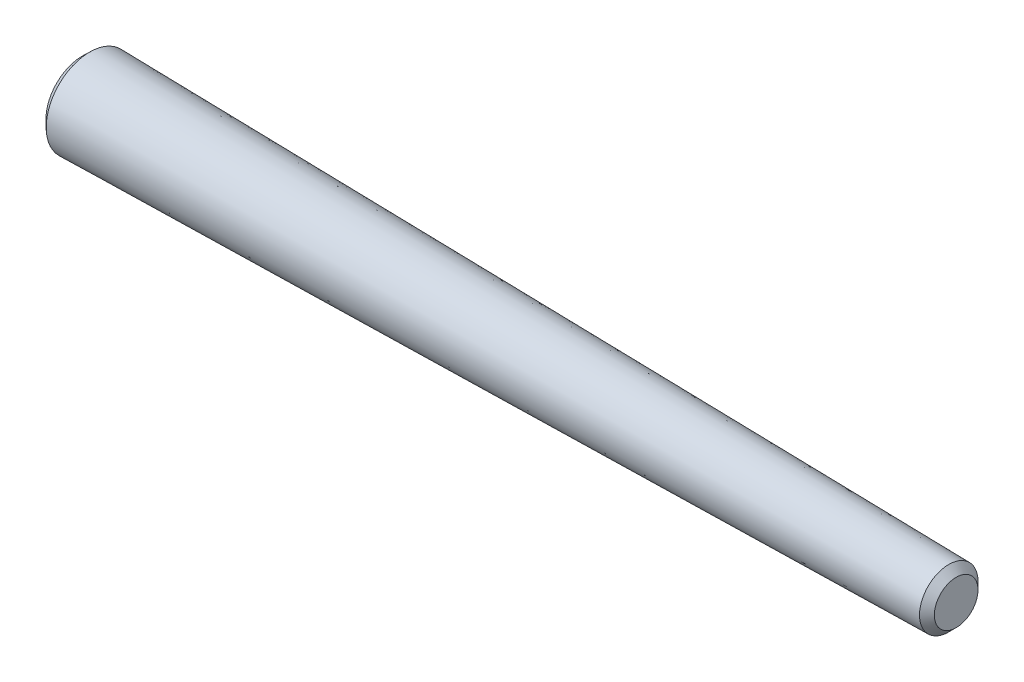
from build123d import *
from OCP.BRepFilletAPI import BRepFilletAPI_MakeChamfer

# Parameters (mm, degrees)
CHAMFER1_SIZE    = 0.5
CHAMFER1_SIZE2   = 0.508545193
CHAMFER1_SIZE2_2 = 0.49187158


with BuildPart() as part:
    # Sketch1 → Revolve1 (revolve)
    with BuildSketch(Plane.XY, mode=Mode.PRIVATE) as revolve1_sk:
        Polygon((0, 0), (0, 3), (60, 2), (60, 0), align=None)
    revolve(revolve1_sk.sketch.rotate(Axis((0, 0, 0), (1, 0, 0)), 90), axis=Axis((0, 0, 0), (1, 0, 0)))

    # Chamfer1: one chamfer whose edges measure the first distance from different faces: ONE call of the kernel's chamfer builder (chamfer() names one face for all edges)
    chamfer1_edges_1 = [part.edges().sort_by_distance(p)[0] for p in [
        (60, 0, -2),
    ]]
    chamfer1_side_1 = [part.faces().sort_by_distance(p)[0] for p in [
        (60, 0, 0),
    ]]
    chamfer1_edges_2 = [part.edges().sort_by_distance(p)[0] for p in [
        (0, 0, -3),
    ]]
    chamfer1_side_2 = [part.faces().sort_by_distance(p)[0] for p in [
        (30, 0, -2.5),
    ]]
    chamfer1 = BRepFilletAPI_MakeChamfer(part.part.solid().wrapped)
    for e in chamfer1_edges_1:
        chamfer1.Add(CHAMFER1_SIZE, CHAMFER1_SIZE2, e.wrapped, chamfer1_side_1[0].wrapped)  # the first distance lies on this face
    for e in chamfer1_edges_2:
        chamfer1.Add(CHAMFER1_SIZE, CHAMFER1_SIZE2_2, e.wrapped, chamfer1_side_2[0].wrapped)  # the first distance lies on this face
    add(Compound.cast(chamfer1.Shape()), mode=Mode.REPLACE)


solid = part.part
